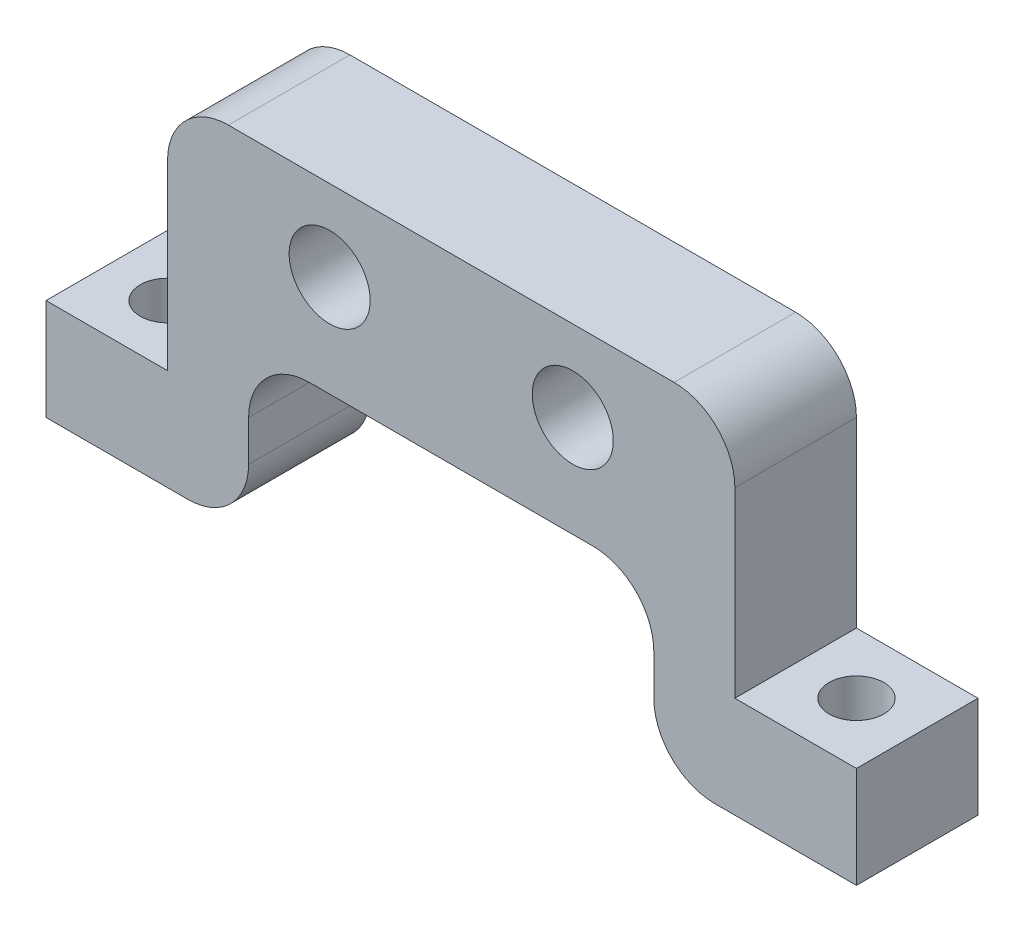
from build123d import *

# Parameters (mm, degrees)
SKETCH_1_W          = 18
SKETCH_1_H          = 17
EXTRUDE_1_DEPTH     = 6
EXTRUDE_2_DEPTH     = 6
SKETCH_8_R          = 1.35
CUT_EXTRUDE_4_DEPTH = 5
SKETCH_9_R          = 2
CUT_EXTRUDE_5_DEPTH = 10
SKETCH_10_W         = 20
SKETCH_10_H         = 8
CUT_EXTRUDE_6_DEPTH = 10
FILLET_1_R          = 3


with BuildPart() as part:
    # 草图1 → 凸台-拉伸1 (new body)
    with BuildSketch(Plane.XY):
        Rectangle(SKETCH_1_W, SKETCH_1_H)
    extrude(amount=EXTRUDE_1_DEPTH)

    # 草图6 → 凸台-拉伸2 (add)
    with BuildSketch(Plane(origin=(0, 0, 0), x_dir=(-1, 0, 0), z_dir=(0, 0, -1))):
        Polygon((-9, 8.5), (-14, 8.5), (-14, -3.5), (-20, -3.5), (-20, -8.5), (-9, -8.5), align=None)
        Polygon((20, -8.5), (20, -3.5), (14, -3.5), (14, 8.5), (9, 8.5), (9, -8.5), align=None)
    extrude(amount=-EXTRUDE_2_DEPTH)

    # 草图8 → 切除-拉伸4 (cut)
    with BuildSketch(Plane(origin=(0, -3.5, 0), x_dir=(1, 0, 0), z_dir=(0, 1, 0))):
        with Locations(Location((17, -3, 0), (0, 0, 180))):
            Circle(SKETCH_8_R)
        with Locations((-17, -3)):
            Circle(SKETCH_8_R)
    extrude(amount=-CUT_EXTRUDE_4_DEPTH, mode=Mode.SUBTRACT)

    # 草图9 → 切除-拉伸5 (cut)
    with BuildSketch(Plane.XY.offset(6)):
        with Locations((-6, 4.5)):
            Circle(SKETCH_9_R)
        with Locations(Location((6, 4.5, 0), (0, 0, 180))):
            Circle(SKETCH_9_R)
    extrude(amount=-CUT_EXTRUDE_5_DEPTH, mode=Mode.SUBTRACT)

    # 草图10 → 切除-拉伸6 (cut)
    with BuildSketch(Plane.XY.offset(6)):
        with Locations((0, -4.5)):
            Rectangle(SKETCH_10_W, SKETCH_10_H)
    extrude(amount=-CUT_EXTRUDE_6_DEPTH, mode=Mode.SUBTRACT)

    # 圆角1
    fillet_1_edges = [part.edges().sort_by_distance(p)[0] for p in [
        (14, 8.5, 3),
        (-14, 8.5, 3),
        (-10, -8.5, 3),
        (-10, -0.5, 3),
        (10, -0.5, 3),
        (10, -8.5, 3),
    ]]
    fillet(fillet_1_edges, radius=FILLET_1_R)


solid = part.part
